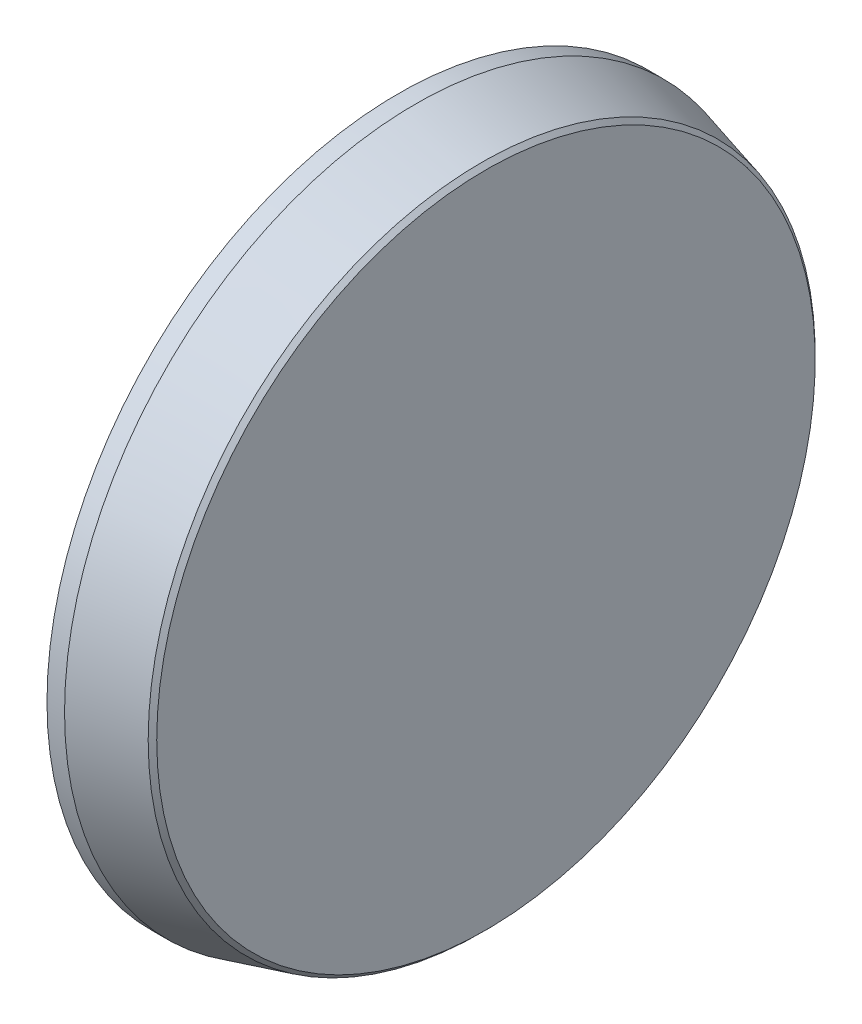
from build123d import *

# Parameters (mm, degrees)
EXTRUDE_6_DEPTH = 60


with BuildPart() as part:
    # Эскиз1 → Повернуть7 (revolve)
    with BuildSketch(Plane.XY, mode=Mode.PRIVATE) as revolve_7_sk:
        Polygon((120, 0), (0, 0), (0, -100), (90, -100), (90, -355), (20, -355), (20, -400), (40, -400), (115.131397208, -379.868602792), (120, -375), align=None)
    revolve(revolve_7_sk.sketch.rotate(Axis((0, 0, 0), (1, 0, 0)), 270), axis=Axis((0, 0, 0), (1, 0, 0)))

    # Эскиз3 → Бобышка-Вытянуть6 (add)
    with BuildSketch(Plane.ZY.offset(-90)):
        with BuildLine():
            ThreePointArc((-48.745403909, -87.314864701), (-70.710678119, -70.710678119), (-87.314864701, -48.745403909))
            ThreePointArc((-87.314864701, -48.745403909), (-86.141576096, -54.996690721), (-88.975283359, -60.691012112))
            Line((-88.975283359, -60.691012112), (-257.169911814, -228.885640567))
            ThreePointArc((-257.169911814, -228.885640567), (-264.676174548, -231.805098536), (-271.900138456, -228.243980661))
            ThreePointArc((-271.900138456, -228.243980661), (-226.413585645, -273.42620254), (-173.542276552, -309.690294083))
            ThreePointArc((-173.542276552, -309.690294083), (-203.646432227, -265.561170399), (-186.637594429, -214.921865676))
            Line((-186.637594429, -214.921865676), (-60.691012112, -88.975283359))
            ThreePointArc((-60.691012112, -88.975283359), (-54.996690721, -86.141576096), (-48.745403909, -87.314864701))
        make_face()
        with BuildLine():
            ThreePointArc((-96.209138584, -27.272727273), (-100, 0), (-96.209138584, 27.272727273))
            ThreePointArc((-96.209138584, 27.272727273), (-99.799825551, 22.022759648), (-105.830052443, 20))
            Line((-105.830052443, 20), (-343.693177122, 20))
            ThreePointArc((-343.693177122, 20), (-351.065274929, 23.243360753), (-353.655298198, 30.869565217))
            ThreePointArc((-353.655298198, 30.869565217), (-353.440103732, -33.242940208), (-341.697027586, -96.271186441))
            ThreePointArc((-341.697027586, -96.271186441), (-331.779877601, -43.780331217), (-283.94541729, -20))
            Line((-283.94541729, -20), (-105.830052443, -20))
            ThreePointArc((-105.830052443, -20), (-99.799825551, -22.022759648), (-96.209138584, -27.272727273))
        make_face()
        with BuildLine():
            ThreePointArc((-87.314864701, 48.745403909), (-70.710678119, 70.710678119), (-48.745403909, 87.314864701))
            ThreePointArc((-48.745403909, 87.314864701), (-54.996690721, 86.141576096), (-60.691012112, 88.975283359))
            Line((-60.691012112, 88.975283359), (-228.885640567, 257.169911814))
            ThreePointArc((-228.885640567, 257.169911814), (-231.805098536, 264.676174548), (-228.243980661, 271.900138456))
            ThreePointArc((-228.243980661, 271.900138456), (-273.42620254, 226.413585645), (-309.690294083, 173.542276552))
            ThreePointArc((-309.690294083, 173.542276552), (-265.561170399, 203.646432227), (-214.921865676, 186.637594429))
            Line((-214.921865676, 186.637594429), (-88.975283359, 60.691012112))
            ThreePointArc((-88.975283359, 60.691012112), (-86.141576096, 54.996690721), (-87.314864701, 48.745403909))
        make_face()
        with BuildLine():
            ThreePointArc((27.272727273, 96.209138584), (22.022759648, 99.799825551), (20, 105.830052443))
            Line((20, 105.830052443), (20, 343.693177122))
            ThreePointArc((20, 343.693177122), (23.243360753, 351.065274929), (30.869565217, 353.655298198))
            ThreePointArc((30.869565217, 353.655298198), (-33.242940208, 353.440103732), (-96.271186441, 341.697027586))
            ThreePointArc((-96.271186441, 341.697027586), (-43.780331217, 331.779877601), (-20, 283.94541729))
            Line((-20, 283.94541729), (-20, 105.830052443))
            ThreePointArc((-20, 105.830052443), (-22.022759648, 99.799825551), (-27.272727273, 96.209138584))
            ThreePointArc((-27.272727273, 96.209138584), (0, 100), (27.272727273, 96.209138584))
        make_face()
        with BuildLine():
            ThreePointArc((60.691012112, 88.975283359), (54.996690721, 86.141576096), (48.745403909, 87.314864701))
            ThreePointArc((48.745403909, 87.314864701), (70.710678119, 70.710678119), (87.314864701, 48.745403909))
            ThreePointArc((87.314864701, 48.745403909), (86.141576096, 54.996690721), (88.975283359, 60.691012112))
            Line((88.975283359, 60.691012112), (257.169911814, 228.885640567))
            ThreePointArc((257.169911814, 228.885640567), (264.676174548, 231.805098536), (271.900138456, 228.243980661))
            ThreePointArc((271.900138456, 228.243980661), (226.413585645, 273.42620254), (173.542276552, 309.690294083))
            ThreePointArc((173.542276552, 309.690294083), (203.646432227, 265.561170399), (186.637594429, 214.921865676))
            Line((186.637594429, 214.921865676), (60.691012112, 88.975283359))
        make_face()
        with BuildLine():
            ThreePointArc((105.830052443, 20), (99.799825551, 22.022759648), (96.209138584, 27.272727273))
            ThreePointArc((96.209138584, 27.272727273), (99.047750753, 13.767464211), (100, 0))
            ThreePointArc((100, 0), (99.047750753, -13.767464211), (96.209138584, -27.272727273))
            ThreePointArc((96.209138584, -27.272727273), (99.799825551, -22.022759648), (105.830052443, -20))
            Line((105.830052443, -20), (343.693177122, -20))
            ThreePointArc((343.693177122, -20), (351.065274929, -23.243360753), (353.655298198, -30.869565217))
            ThreePointArc((353.655298198, -30.869565217), (354.663665224, -15.449419727), (355, 0))
            ThreePointArc((355, 0), (351.658530959, 48.592978952), (341.697027586, 96.271186441))
            ThreePointArc((341.697027586, 96.271186441), (331.779877601, 43.780331217), (283.94541729, 20))
            Line((283.94541729, 20), (105.830052443, 20))
        make_face()
        with BuildLine():
            ThreePointArc((88.975283359, -60.691012112), (86.141576096, -54.996690721), (87.314864701, -48.745403909))
            ThreePointArc((87.314864701, -48.745403909), (70.710678119, -70.710678119), (48.745403909, -87.314864701))
            ThreePointArc((48.745403909, -87.314864701), (54.996690721, -86.141576096), (60.691012112, -88.975283359))
            Line((60.691012112, -88.975283359), (228.885640567, -257.169911814))
            ThreePointArc((228.885640567, -257.169911814), (231.805098536, -264.676174548), (228.243980661, -271.900138456))
            ThreePointArc((228.243980661, -271.900138456), (273.42620254, -226.413585645), (309.690294083, -173.542276552))
            ThreePointArc((309.690294083, -173.542276552), (265.561170399, -203.646432227), (214.921865676, -186.637594429))
            Line((214.921865676, -186.637594429), (88.975283359, -60.691012112))
        make_face()
        with BuildLine():
            ThreePointArc((20, -105.830052443), (22.022759648, -99.799825551), (27.272727273, -96.209138584))
            ThreePointArc((27.272727273, -96.209138584), (0, -100), (-27.272727273, -96.209138584))
            ThreePointArc((-27.272727273, -96.209138584), (-22.022759648, -99.799825551), (-20, -105.830052443))
            Line((-20, -105.830052443), (-20, -343.693177122))
            ThreePointArc((-20, -343.693177122), (-23.243360753, -351.065274929), (-30.869565217, -353.655298198))
            ThreePointArc((-30.869565217, -353.655298198), (33.242940208, -353.440103732), (96.271186441, -341.697027586))
            ThreePointArc((96.271186441, -341.697027586), (43.780331217, -331.779877601), (20, -283.94541729))
            Line((20, -283.94541729), (20, -105.830052443))
        make_face()
    extrude(amount=EXTRUDE_6_DEPTH)


solid = part.part
